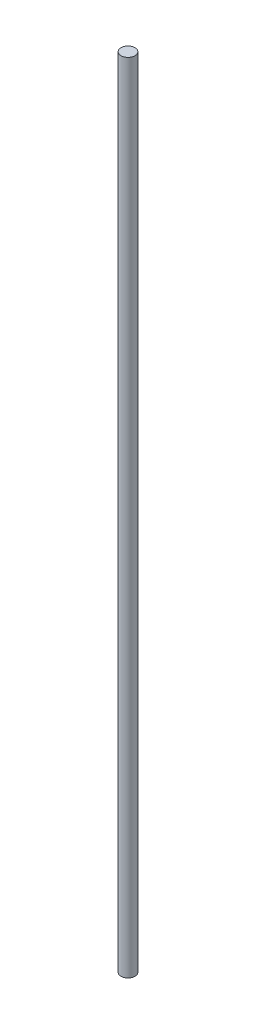
from build123d import *

# Parameters (mm, degrees)
SKETCH1_R           = 4
BOSS_EXTRUDE1_DEPTH = 457


with BuildPart() as part:
    # Sketch1 → Boss-Extrude1 (new body)
    with BuildSketch(Plane(origin=(0, 0, 0), x_dir=(1, 0, 0), z_dir=(0, 1, 0))):
        with Locations(Location((0, 0, 0), (0, 0, 270))):
            Circle(SKETCH1_R)
    extrude(amount=BOSS_EXTRUDE1_DEPTH)


solid = part.part
